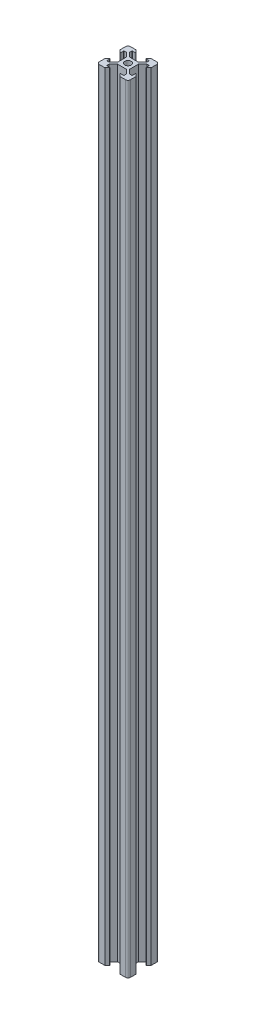
from build123d import *

# Parameters (mm, degrees)
SALIENTE_EXTRUIR1_DEPTH = 500
REDONDEO1_R             = 1.5
REDONDEO2_R             = 0.2


with BuildPart() as part:
    # Croquis1 → Saliente-Extruir1 (new body)
    with BuildSketch(Plane(origin=(0, 0, 0), x_dir=(1, 0, 0), z_dir=(0, 1, 0))):
        with BuildLine():
            Line((-4.9, 10), (-10, 10))
            Line((-10, 10), (-10, 4.9))
            Line((-10, 4.9), (-8.2, 3.1))
            Line((-8.2, 3.1), (-8.2, 5.539339828))
            Line((-8.2, 5.539339828), (-6.6, 5.539339828))
            Line((-6.6, 5.539339828), (-3.900660172, 2.84))
            Line((-3.900660172, 2.84), (-1.917323237, 0.856663065))
            ThreePointArc((-1.917323237, 0.856663065), (-1.48492424, 1.48492424), (-0.856663065, 1.917323237))
            Line((-0.856663065, 1.917323237), (-2.84, 3.900660172))
            Line((-2.84, 3.900660172), (-5.539339828, 6.6))
            Line((-5.539339828, 6.6), (-5.539339828, 8.2))
            Line((-5.539339828, 8.2), (-3.1, 8.2))
            Line((-3.1, 8.2), (-4.9, 10))
        make_face()
        with BuildLine():
            Line((-8.2, -3.1), (-10, -4.9))
            Line((-10, -4.9), (-10, -10))
            Line((-10, -10), (-4.9, -10))
            Line((-4.9, -10), (-3.1, -8.2))
            Line((-3.1, -8.2), (-5.539339828, -8.2))
            Line((-5.539339828, -8.2), (-5.539339828, -6.6))
            Line((-5.539339828, -6.6), (-2.84, -3.900660172))
            Line((-2.84, -3.900660172), (-0.856663065, -1.917323237))
            ThreePointArc((-0.856663065, -1.917323237), (-1.48492424, -1.48492424), (-1.917323237, -0.856663065))
            Line((-1.917323237, -0.856663065), (-3.900660172, -2.84))
            Line((-3.900660172, -2.84), (-6.6, -5.539339828))
            Line((-6.6, -5.539339828), (-8.2, -5.539339828))
            Line((-8.2, -5.539339828), (-8.2, -3.1))
        make_face()
        with BuildLine():
            Line((10, -10), (10, -4.9))
            Line((10, -4.9), (8.2, -3.1))
            Line((8.2, -3.1), (8.2, -5.539339828))
            Line((8.2, -5.539339828), (6.6, -5.539339828))
            Line((6.6, -5.539339828), (3.900660172, -2.84))
            Line((3.900660172, -2.84), (1.917323237, -0.856663065))
            ThreePointArc((1.917323237, -0.856663065), (1.48492424, -1.48492424), (0.856663065, -1.917323237))
            Line((0.856663065, -1.917323237), (2.84, -3.900660172))
            Line((2.84, -3.900660172), (5.539339828, -6.6))
            Line((5.539339828, -6.6), (5.539339828, -8.2))
            Line((5.539339828, -8.2), (3.1, -8.2))
            Line((3.1, -8.2), (4.9, -10))
            Line((4.9, -10), (10, -10))
        make_face()
        with BuildLine():
            Line((10, 10), (4.9, 10))
            Line((4.9, 10), (3.1, 8.2))
            Line((3.1, 8.2), (5.539339828, 8.2))
            Line((5.539339828, 8.2), (5.539339828, 6.6))
            Line((5.539339828, 6.6), (2.84, 3.900660172))
            Line((2.84, 3.900660172), (0.856663065, 1.917323237))
            ThreePointArc((0.856663065, 1.917323237), (1.48492424, 1.48492424), (1.917323237, 0.856663065))
            Line((1.917323237, 0.856663065), (3.900660172, 2.84))
            Line((3.900660172, 2.84), (6.6, 5.539339828))
            Line((6.6, 5.539339828), (8.2, 5.539339828))
            Line((8.2, 5.539339828), (8.2, 3.1))
            Line((8.2, 3.1), (10, 4.9))
            Line((10, 4.9), (10, 10))
        make_face()
        with BuildLine():
            Line((-1.917323237, 0.856663065), (-3.900660172, 2.84))
            Line((-3.900660172, 2.84), (-3.900660172, -2.84))
            Line((-3.900660172, -2.84), (-1.917323237, -0.856663065))
            ThreePointArc((-1.917323237, -0.856663065), (-2.1, 0), (-1.917323237, 0.856663065))
        make_face()
        with BuildLine():
            Line((-0.856663065, -1.917323237), (-2.84, -3.900660172))
            Line((-2.84, -3.900660172), (2.84, -3.900660172))
            Line((2.84, -3.900660172), (0.856663065, -1.917323237))
            ThreePointArc((0.856663065, -1.917323237), (0, -2.1), (-0.856663065, -1.917323237))
        make_face()
        with BuildLine():
            Line((3.900660172, -2.84), (3.900660172, 2.84))
            Line((3.900660172, 2.84), (1.917323237, 0.856663065))
            ThreePointArc((1.917323237, 0.856663065), (2.053823118, 0.437961872), (2.1, 0))
            ThreePointArc((2.1, 0), (2.053823118, -0.437961872), (1.917323237, -0.856663065))
            Line((1.917323237, -0.856663065), (3.900660172, -2.84))
        make_face()
        with BuildLine():
            Line((2.84, 3.900660172), (-2.84, 3.900660172))
            Line((-2.84, 3.900660172), (-0.856663065, 1.917323237))
            ThreePointArc((-0.856663065, 1.917323237), (0, 2.1), (0.856663065, 1.917323237))
            Line((0.856663065, 1.917323237), (2.84, 3.900660172))
        make_face()
    extrude(amount=SALIENTE_EXTRUIR1_DEPTH)

    # Redondeo1
    redondeo1_edges = [part.edges().sort_by_distance(p)[0] for p in [
        (-10, 250, 10),
        (-10, 250, -10),
        (10, 250, -10),
        (10, 250, 10),
    ]]
    fillet(redondeo1_edges, radius=REDONDEO1_R)

    # Redondeo2
    redondeo2_edges = [part.edges().sort_by_distance(p)[0] for p in [
        (-5.539339828, 250, 8.2),
        (-3.1, 250, 8.2),
        (-8.2, 250, 3.1),
        (-8.2, 250, 5.539339828),
        (-8.2, 250, -5.539339828),
        (-8.2, 250, -3.1),
        (-3.1, 250, -8.2),
        (-5.539339828, 250, -8.2),
        (5.539339828, 250, -8.2),
        (3.1, 250, -8.2),
        (8.2, 250, -3.1),
        (8.2, 250, -5.539339828),
        (8.2, 250, 5.539339828),
        (8.2, 250, 3.1),
        (3.1, 250, 8.2),
        (5.539339828, 250, 8.2),
    ]]
    fillet(redondeo2_edges, radius=REDONDEO2_R)


solid = part.part
